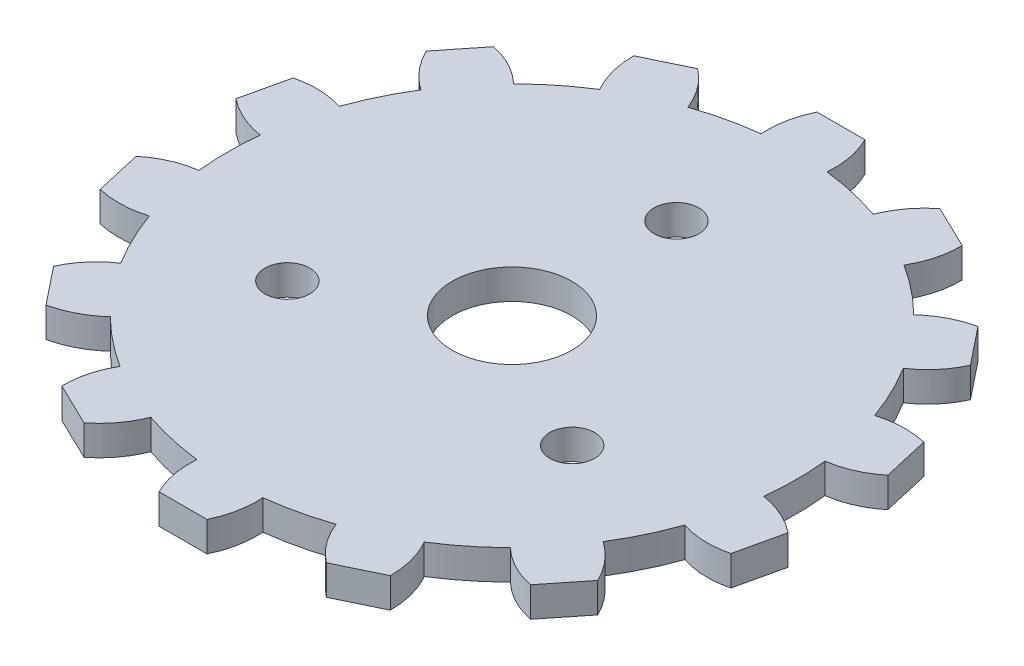
from build123d import *

# Parameters (mm, degrees)
SKETCH1_R           = 4
SKETCH1_R_2         = 1.5
BOSS_EXTRUDE1_DEPTH = 2


with BuildPart() as part:
    # Sketch1 → Boss-Extrude1 (new body)
    with BuildSketch(Plane(origin=(0, 0, 0), x_dir=(1, 0, 0), z_dir=(0, 1, 0))):
        with BuildLine():
            Line((0, 22), (-1.6, 22))
            add(Edge.make_bspline(
                [(-1.6, 22), (-2.318149564, 20.509493388), (-2.205951168, 18.871507079)],
                knots=[0, 0, 0, 1, 1, 1], degree=2))
            ThreePointArc((-2.205951168, 18.871507079), (-4.227897745, 18.523630331), (-6.200546728, 17.95976671))
            add(Edge.make_bspline(
                [(-8.103892072, 20.515529076), (-6.785743067, 19.501097309), (-6.200546728, 17.95976671)],
                knots=[0, 0, 0, 1, 1, 1], degree=2))
            Line((-8.103892072, 20.515529076), (-9.545442261, 19.821315094))
            Line((-9.545442261, 19.821315094), (-10.986992449, 19.127101111))
            add(Edge.make_bspline(
                [(-10.986992449, 19.127101111), (-10.987316267, 17.472607638), (-10.175533381, 16.045514028)],
                knots=[0, 0, 0, 1, 1, 1], degree=2))
            ThreePointArc((-10.175533381, 16.045514028), (-11.846306235, 14.854798167), (-13.3789503, 13.490874281))
            add(Edge.make_bspline(
                [(-16.202708931, 14.967706013), (-14.574952266, 14.62565799), (-13.3789503, 13.490874281)],
                knots=[0, 0, 0, 1, 1, 1], degree=2))
            Line((-16.202708931, 14.967706013), (-17.200292614, 13.716775641))
            Line((-17.200292614, 13.716775641), (-18.197876297, 12.465845269))
            add(Edge.make_bspline(
                [(-18.197876297, 12.465845269), (-17.480310233, 10.975057658), (-16.129726413, 10.041510138)],
                knots=[0, 0, 0, 1, 1, 1], degree=2))
            ThreePointArc((-16.129726413, 10.041510138), (-17.11840849, 8.243791043), (-17.907488682, 6.349948747))
            add(Edge.make_bspline(
                [(-21.092380574, 6.455345207), (-19.477413419, 6.853427735), (-17.907488682, 6.349948747)],
                knots=[0, 0, 0, 1, 1, 1], degree=2))
            Line((-21.092380574, 6.455345207), (-21.448414068, 4.895460547))
            Line((-21.448414068, 4.895460547), (-21.804447562, 3.335575888))
            add(Edge.make_bspline(
                [(-21.804447562, 3.335575888), (-20.511114375, 2.303762909), (-18.889229311, 2.048662014)],
                knots=[0, 0, 0, 1, 1, 1], degree=2))
            ThreePointArc((-18.889229311, 2.048662014), (-19, 0), (-18.889229311, -2.048662014))
            add(Edge.make_bspline(
                [(-21.804447562, -3.335575888), (-20.522133969, -2.276207935), (-18.889229311, -2.048662014)],
                knots=[0, 0, 0, 1, 1, 1], degree=2))
            Line((-21.804447562, -3.335575888), (-21.448414068, -4.895460547))
            Line((-21.448414068, -4.895460547), (-21.092380574, -6.455345207))
            add(Edge.make_bspline(
                [(-21.092380574, -6.455345207), (-19.479440763, -6.823820339), (-17.907488682, -6.349948747)],
                knots=[0, 0, 0, 1, 1, 1], degree=2))
            ThreePointArc((-17.907488682, -6.349948747), (-17.11840849, -8.243791043), (-16.129726413, -10.041510138))
            add(Edge.make_bspline(
                [(-18.197876297, -12.465845269), (-17.502194199, -10.955012707), (-16.129726413, -10.041510138)],
                knots=[0, 0, 0, 1, 1, 1], degree=2))
            Line((-18.197876297, -12.465845269), (-17.200292614, -13.716775641))
            Line((-17.200292614, -13.716775641), (-16.202708931, -14.967706013))
            add(Edge.make_bspline(
                [(-16.202708931, -14.967706013), (-14.589625008, -14.599862279), (-13.3789503, -13.490874281)],
                knots=[0, 0, 0, 1, 1, 1], degree=2))
            ThreePointArc((-13.3789503, -13.490874281), (-11.846306235, -14.854798167), (-10.175533381, -16.045514028))
            add(Edge.make_bspline(
                [(-10.986992449, -19.127101111), (-11.015730218, -17.464042859), (-10.175533381, -16.045514028)],
                knots=[0, 0, 0, 1, 1, 1], degree=2))
            Line((-10.986992449, -19.127101111), (-9.545442261, -19.821315094))
            Line((-9.545442261, -19.821315094), (-8.103892072, -20.515529076))
            add(Edge.make_bspline(
                [(-8.103892072, -20.515529076), (-6.81015509, -19.48422244), (-6.200546728, -17.95976671)],
                knots=[0, 0, 0, 1, 1, 1], degree=2))
            ThreePointArc((-6.200546728, -17.95976671), (-4.227897745, -18.523630331), (-2.205951168, -18.871507079))
            add(Edge.make_bspline(
                [(-1.6, -22), (-2.347465768, -20.514105139), (-2.205951168, -18.871507079)],
                knots=[0, 0, 0, 1, 1, 1], degree=2))
            Line((-1.6, -22), (0, -22))
            Line((0, -22), (1.6, -22))
            add(Edge.make_bspline(
                [(1.6, -22), (2.318149564, -20.509493388), (2.205951168, -18.871507079)],
                knots=[0, 0, 0, 1, 1, 1], degree=2))
            ThreePointArc((2.205951168, -18.871507079), (4.227897745, -18.523630331), (6.200546728, -17.95976671))
            add(Edge.make_bspline(
                [(8.103892072, -20.515529076), (6.785743067, -19.501097309), (6.200546728, -17.95976671)],
                knots=[0, 0, 0, 1, 1, 1], degree=2))
            Line((8.103892072, -20.515529076), (9.545442261, -19.821315094))
            Line((9.545442261, -19.821315094), (10.986992449, -19.127101111))
            add(Edge.make_bspline(
                [(10.986992449, -19.127101111), (10.987316267, -17.472607638), (10.175533381, -16.045514028)],
                knots=[0, 0, 0, 1, 1, 1], degree=2))
            ThreePointArc((10.175533381, -16.045514028), (11.846306235, -14.854798167), (13.3789503, -13.490874281))
            add(Edge.make_bspline(
                [(16.202708931, -14.967706013), (14.574952266, -14.62565799), (13.3789503, -13.490874281)],
                knots=[0, 0, 0, 1, 1, 1], degree=2))
            Line((16.202708931, -14.967706013), (17.200292614, -13.716775641))
            Line((17.200292614, -13.716775641), (18.197876297, -12.465845269))
            add(Edge.make_bspline(
                [(18.197876297, -12.465845269), (17.480310233, -10.975057658), (16.129726413, -10.041510138)],
                knots=[0, 0, 0, 1, 1, 1], degree=2))
            ThreePointArc((16.129726413, -10.041510138), (17.11840849, -8.243791043), (17.907488682, -6.349948747))
            add(Edge.make_bspline(
                [(21.092380574, -6.455345207), (19.477413419, -6.853427735), (17.907488682, -6.349948747)],
                knots=[0, 0, 0, 1, 1, 1], degree=2))
            Line((21.092380574, -6.455345207), (21.448414068, -4.895460547))
            Line((21.448414068, -4.895460547), (21.804447562, -3.335575888))
            add(Edge.make_bspline(
                [(21.804447562, -3.335575888), (20.511114375, -2.303762909), (18.889229311, -2.048662014)],
                knots=[0, 0, 0, 1, 1, 1], degree=2))
            ThreePointArc((18.889229311, -2.048662014), (19, 0), (18.889229311, 2.048662014))
            add(Edge.make_bspline(
                [(21.804447562, 3.335575888), (20.522133969, 2.276207935), (18.889229311, 2.048662014)],
                knots=[0, 0, 0, 1, 1, 1], degree=2))
            Line((21.804447562, 3.335575888), (21.448414068, 4.895460547))
            Line((21.448414068, 4.895460547), (21.092380574, 6.455345207))
            add(Edge.make_bspline(
                [(21.092380574, 6.455345207), (19.479440763, 6.823820339), (17.907488682, 6.349948747)],
                knots=[0, 0, 0, 1, 1, 1], degree=2))
            ThreePointArc((17.907488682, 6.349948747), (17.11840849, 8.243791043), (16.129726413, 10.041510138))
            add(Edge.make_bspline(
                [(18.197876297, 12.465845269), (17.502194199, 10.955012707), (16.129726413, 10.041510138)],
                knots=[0, 0, 0, 1, 1, 1], degree=2))
            Line((18.197876297, 12.465845269), (17.200292614, 13.716775641))
            Line((17.200292614, 13.716775641), (16.202708931, 14.967706013))
            add(Edge.make_bspline(
                [(16.202708931, 14.967706013), (14.589625008, 14.599862279), (13.3789503, 13.490874281)],
                knots=[0, 0, 0, 1, 1, 1], degree=2))
            ThreePointArc((13.3789503, 13.490874281), (11.846306235, 14.854798167), (10.175533381, 16.045514028))
            add(Edge.make_bspline(
                [(10.986992449, 19.127101111), (11.015730218, 17.464042859), (10.175533381, 16.045514028)],
                knots=[0, 0, 0, 1, 1, 1], degree=2))
            Line((10.986992449, 19.127101111), (9.545442261, 19.821315094))
            Line((9.545442261, 19.821315094), (8.103892072, 20.515529076))
            add(Edge.make_bspline(
                [(8.103892072, 20.515529076), (6.81015509, 19.48422244), (6.200546728, 17.95976671)],
                knots=[0, 0, 0, 1, 1, 1], degree=2))
            ThreePointArc((6.200546728, 17.95976671), (4.227897745, 18.523630331), (2.205951168, 18.871507079))
            add(Edge.make_bspline(
                [(1.6, 22), (2.347465768, 20.514105139), (2.205951168, 18.871507079)],
                knots=[0, 0, 0, 1, 1, 1], degree=2))
            Line((1.6, 22), (0, 22))
        make_face()
        with Locations(Location((0, 0, 0), (0, 0, 270))):
            Circle(SKETCH1_R, mode=Mode.SUBTRACT)
        with Locations(Location((0, 11, 0), (0, 0, 270))):
            Circle(SKETCH1_R_2, mode=Mode.SUBTRACT)
        with Locations(Location((9.526279442, -5.5, 0), (0, 0, 270))):
            Circle(SKETCH1_R_2, mode=Mode.SUBTRACT)
        with Locations(Location((-9.526279442, -5.5, 0), (0, 0, 270))):
            Circle(SKETCH1_R_2, mode=Mode.SUBTRACT)
    extrude(amount=BOSS_EXTRUDE1_DEPTH)


solid = part.part
